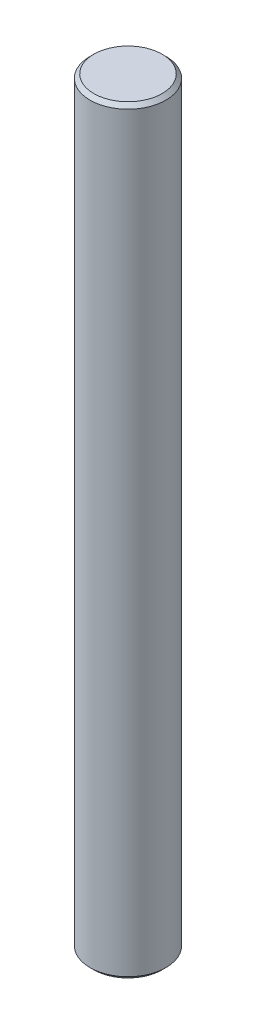
from build123d import *

# Parameters (mm, degrees)
SZKIC1_R                    = 2.5
DODANIE_WYCI_GNI_CIE1_DEPTH = 50
SFAZOWANIE1_SIZE            = 0.25


with BuildPart() as part:
    # Szkic1 → Dodanie-wyciągnięcie1 (new body)
    with BuildSketch(Plane(origin=(0, 0, 0), x_dir=(1, 0, 0), z_dir=(0, 1, 0))):
        with Locations(Location((0, 0, 0), (0, 0, 270))):
            Circle(SZKIC1_R)
    extrude(amount=DODANIE_WYCI_GNI_CIE1_DEPTH)

    # Sfazowanie1
    sfazowanie1_edges = [part.edges().sort_by_distance(p)[0] for p in [
        (0, 0, -2.5),
        (0, 50, -2.5),
    ]]
    chamfer(sfazowanie1_edges, length=SFAZOWANIE1_SIZE)


solid = part.part
